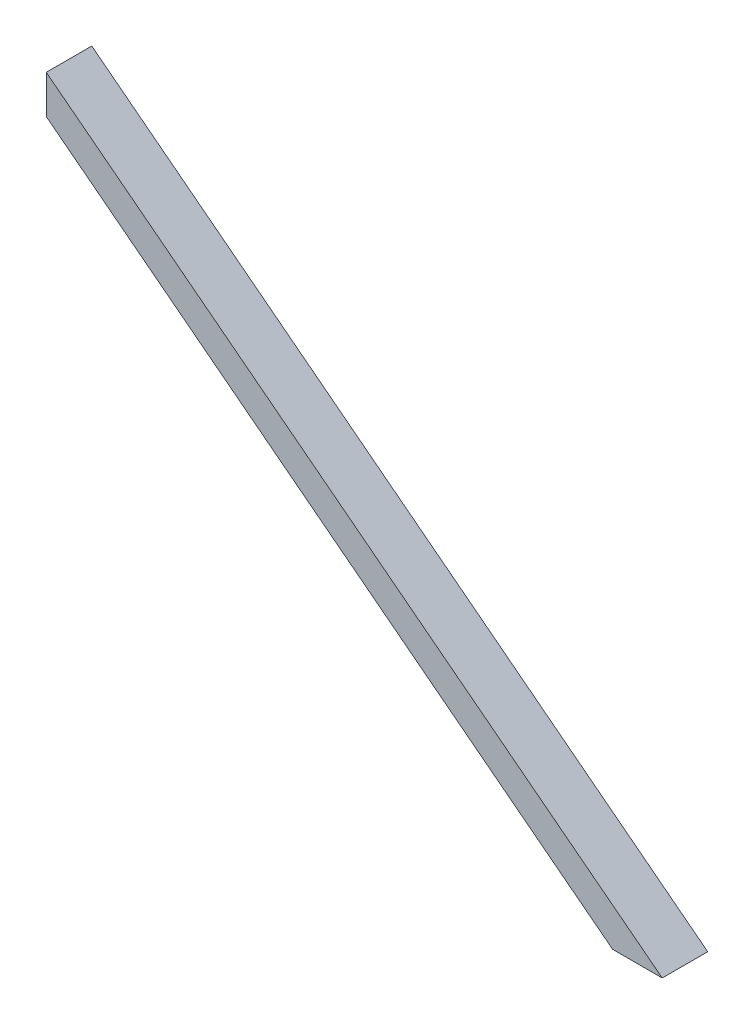
from build123d import *

# Parameters (mm, degrees)
BOSS_EXTRUDE1_DEPTH = 38.1
CUT_EXTRUDE1_DEPTH  = 127
CUT_EXTRUDE3_DEPTH  = 127


with BuildPart() as part:
    # Sketch1 → Boss-Extrude1 (new body)
    with BuildSketch(Plane.XY):
        Polygon((0, 398.78), (515.62, 0), (531.159215878, 20.092107154), (15.539215878, 418.872107154), align=None)
    extrude(amount=-BOSS_EXTRUDE1_DEPTH)

    # Sketch3 → Cut-Extrude1 (cut)
    with BuildSketch(Plane.XY):
        Polygon((15.539215878, 418.872107154), (15.539215878, 386.76198575), (0, 398.78), align=None)
    extrude(amount=-CUT_EXTRUDE1_DEPTH, mode=Mode.SUBTRACT)

    # Sketch4 → Cut-Extrude3 (cut)
    with BuildSketch(Plane.XY):
        Polygon((531.159215878, 20.092107154), (489.641033425, 20.092107154), (515.62, 0), align=None)
    extrude(amount=-CUT_EXTRUDE3_DEPTH, mode=Mode.SUBTRACT)


solid = part.part
